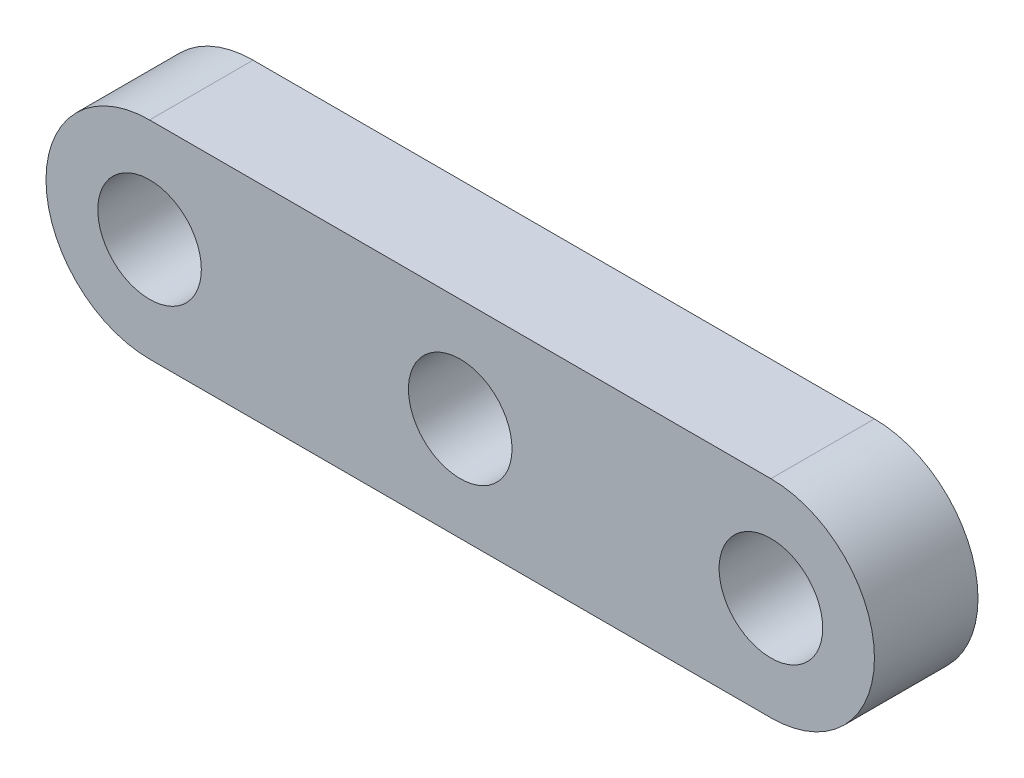
from build123d import *

# Parameters (mm, degrees)
BOSS_EXTRUDE1_DEPTH = 6.35
SKETCH3_R           = 3.175
CUT_EXTRUDE1_DEPTH  = 27.940768363


with BuildPart() as part:
    # Sketch2 → Boss-Extrude1 (new body)
    with BuildSketch(Plane.XY):
        with BuildLine():
            Line((19.05, -6.35), (-19.05, -6.35))
            ThreePointArc((-19.05, -6.35), (-25.4, 0), (-19.05, 6.35))
            Line((-19.05, 6.35), (19.05, 6.35))
            ThreePointArc((19.05, 6.35), (25.4, 0), (19.05, -6.35))
        make_face()
    extrude(amount=BOSS_EXTRUDE1_DEPTH)

    # Sketch3 → Cut-Extrude1 (cut, through all)
    with BuildSketch(Plane.XY.offset(6.35)):
        with Locations((-19.05, 0)):
            Circle(SKETCH3_R)
        Circle(SKETCH3_R)
        with Locations((19.05, 0)):
            Circle(SKETCH3_R)
    extrude(amount=-CUT_EXTRUDE1_DEPTH, mode=Mode.SUBTRACT)


solid = part.part
